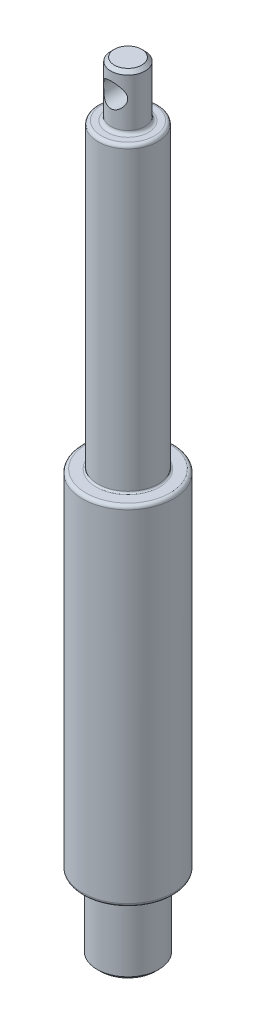
from build123d import *

# Parameters (mm, degrees)
CORTAR_EXTRUIR1_DEPTH             = 228.772090037
CORTAR_EXTRUIR1_DEPTH_BACK        = 228.772090037
CROQUIS3_R                        = 3.5
CHAFL_N2_SIZE                     = 1
REDONDEO1_R                       = 1
REDONDEO3_R                       = 1
CHAFL_N3_SIZE                     = 1
TALADRO_DE_MARGEN_PARA_M121_D     = 10.25
TALADRO_DE_MARGEN_PARA_M121_DEPTH = 15
TALADRO_DE_MARGEN_PARA_M121_TIP   = 3.079410673
REDONDEO4_R                       = 0.5


with BuildPart() as part:
    # Croquis1 → Revolución1 (revolve)
    with BuildSketch(Plane(origin=(0, 0, 0), x_dir=(0, 0, -1), z_dir=(1, 0, 0)), mode=Mode.PRIVATE) as revoluci_n1_sk:
        Polygon((0, 227), (0, 0), (9, 0), (9, 21.5), (13.25, 21.5), (13.25, 123), (8.75, 123), (8.75, 211), (5, 211), (5, 227), align=None)
    revolve(revoluci_n1_sk.sketch.rotate(Axis((0, 227, 0), (0, -1, 0)), 180), axis=Axis((0, 227, 0), (0, -1, 0)))

    # Croquis3 → Cortar-Extruir1 (cut, two sides: drawn at the far end of the back side and taken through both)
    with BuildSketch(Plane.XY.offset(-CORTAR_EXTRUIR1_DEPTH_BACK)):
        with Locations((0, 220)):
            Circle(CROQUIS3_R)
    extrude(amount=CORTAR_EXTRUIR1_DEPTH + CORTAR_EXTRUIR1_DEPTH_BACK, mode=Mode.SUBTRACT)

    # Chaflán2
    chafl_n2_edges = [part.edges().sort_by_distance(p)[0] for p in [
        (0, 227, -5),
    ]]
    chamfer(chafl_n2_edges, length=CHAFL_N2_SIZE)

    # Redondeo1
    redondeo1_edges = [part.edges().sort_by_distance(p)[0] for p in [
        (0, 21.5, -13.25),
        (0, 21.5, -9),
        (0, 211, -8.75),
        (0, 123, -13.25),
    ]]
    fillet(redondeo1_edges, radius=REDONDEO1_R)

    # Redondeo3
    redondeo3_edges = [part.edges().sort_by_distance(p)[0] for p in [
        (0, 211, -5),
    ]]
    fillet(redondeo3_edges, radius=REDONDEO3_R)

    # Chaflán3
    chafl_n3_edges = [part.edges().sort_by_distance(p)[0] for p in [
        (0, 0, -9),
    ]]
    chamfer(chafl_n3_edges, length=CHAFL_N3_SIZE)

    # Taladro de margen para M121
    with Locations(Plane(origin=(0, 0, 0), x_dir=(-1, 0, 0), z_dir=(0, -1, 0))):
        with Locations((0, 0)):
            Hole(TALADRO_DE_MARGEN_PARA_M121_D / 2, depth=TALADRO_DE_MARGEN_PARA_M121_DEPTH)
            with Locations((0, 0, -(TALADRO_DE_MARGEN_PARA_M121_DEPTH + TALADRO_DE_MARGEN_PARA_M121_TIP / 2))):  # 118° drill point
                Cone(0, TALADRO_DE_MARGEN_PARA_M121_D / 2, TALADRO_DE_MARGEN_PARA_M121_TIP, mode=Mode.SUBTRACT)

    # Redondeo4
    redondeo4_edges = [part.edges().sort_by_distance(p)[0] for p in [
        (0, 123, -8.75),
    ]]
    fillet(redondeo4_edges, radius=REDONDEO4_R)


solid = part.part
